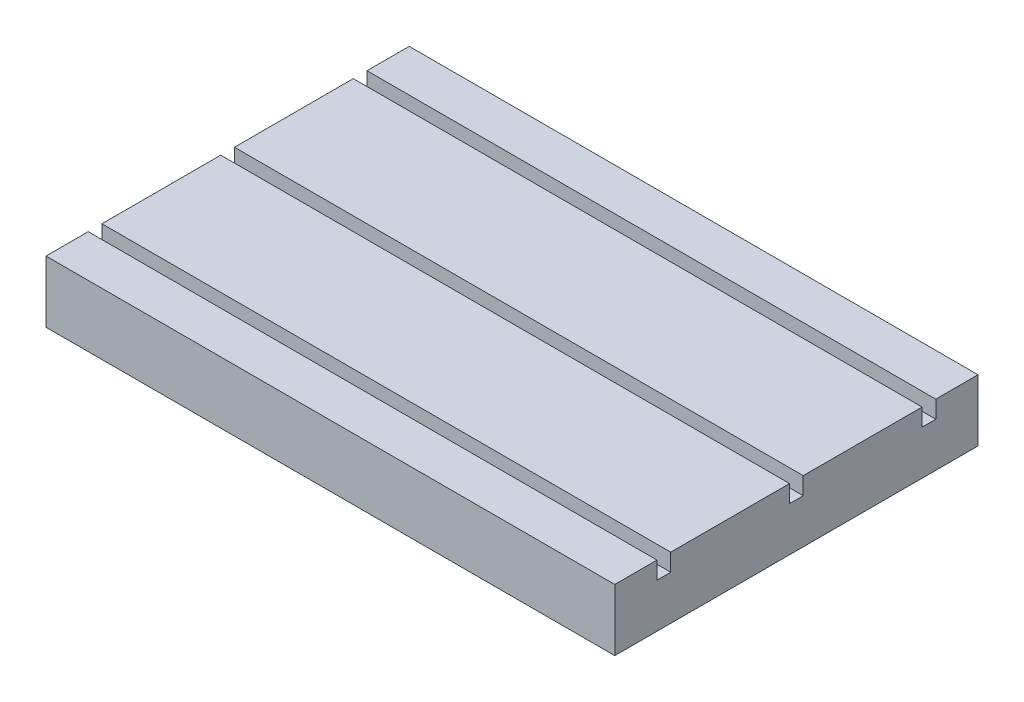
from build123d import *

# Parameters (mm, degrees)
SKETCH1_W           = 83
SKETCH1_H           = 53
BOSS_EXTRUDE1_DEPTH = 9
SKETCH2_W           = 83
SKETCH2_H           = 2
CUT_EXTRUDE1_DEPTH  = 2.54


with BuildPart() as part:
    # Sketch1 → Boss-Extrude1 (new body)
    with BuildSketch(Plane(origin=(0, 0, 0), x_dir=(1, 0, 0), z_dir=(0, 1, 0))):
        with Locations((41.5, -26.5)):
            Rectangle(SKETCH1_W, SKETCH1_H)
    extrude(amount=BOSS_EXTRUDE1_DEPTH)

    # Sketch2 → Cut-Extrude1 (cut)
    with BuildSketch(Plane(origin=(0, 9, 0), x_dir=(1, 0, 0), z_dir=(0, 1, 0))):
        Polygon((0, -27.5), (0, -25.5), (83, -25.5), (83, -26.5), (83, -27.5), align=None)
        with Locations((41.5, -7.159340371)):
            Rectangle(SKETCH2_W, SKETCH2_H)
        with Locations((41.5, -45.840659629)):
            Rectangle(SKETCH2_W, SKETCH2_H)
    extrude(amount=-CUT_EXTRUDE1_DEPTH, mode=Mode.SUBTRACT)


solid = part.part
